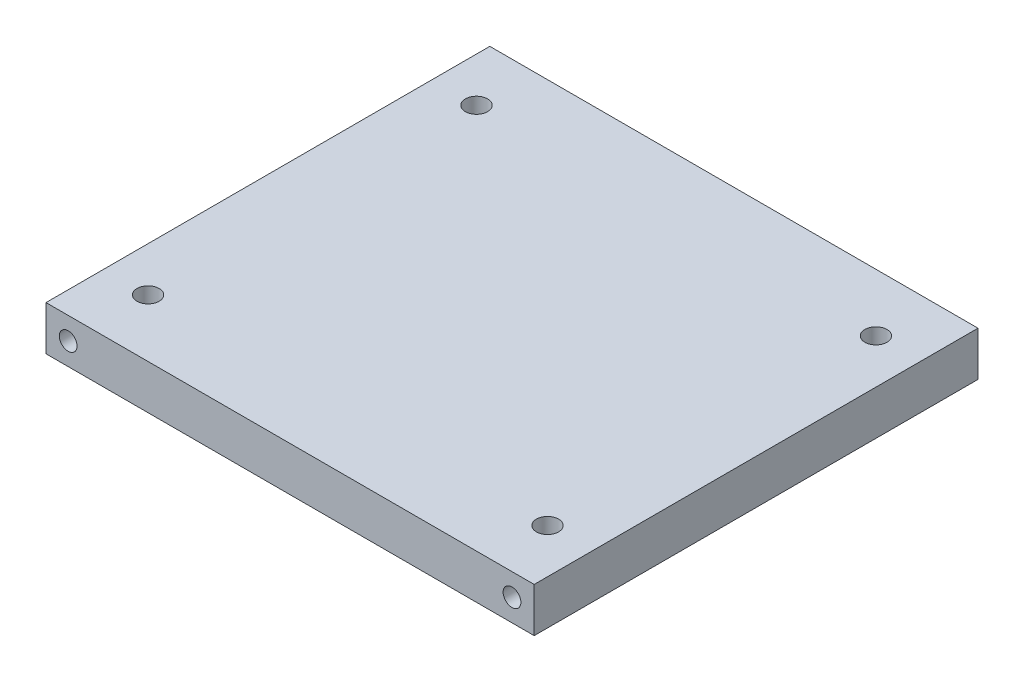
from build123d import *

# Parameters (mm, degrees)
SKETCH1_W           = 110
SKETCH1_H           = 100
BOSS_EXTRUDE1_DEPTH = 10
SKETCH2_R           = 2
CUT_EXTRUDE1_DEPTH  = 115.564392374
SKETCH3_R           = 2.5
CUT_EXTRUDE2_DEPTH  = 10


with BuildPart() as part:
    # Sketch1 → Boss-Extrude1 (new body)
    with BuildSketch(Plane(origin=(0, 0, 0), x_dir=(1, 0, 0), z_dir=(0, 1, 0))):
        Rectangle(SKETCH1_W, SKETCH1_H)
    extrude(amount=BOSS_EXTRUDE1_DEPTH)

    # Sketch2 → Cut-Extrude1 (cut, through all)
    with BuildSketch(Plane.XY.offset(50)):
        with Locations((-50, 5)):
            Circle(SKETCH2_R)
        with Locations(Location((50, 5, 0), (0, 0, 180))):
            Circle(SKETCH2_R)
    extrude(amount=-CUT_EXTRUDE1_DEPTH, mode=Mode.SUBTRACT)

    # Sketch3 → Cut-Extrude2 (cut)
    with BuildSketch(Plane(origin=(0, 10, 0), x_dir=(1, 0, 0), z_dir=(0, 1, 0))):
        with Locations(Location((-45, -37, 0), (0, 0, 270))):
            Circle(SKETCH3_R)
        with Locations(Location((45, -37, 0), (0, 0, 90))):
            Circle(SKETCH3_R)
        with Locations(Location((45, 37, 0), (0, 0, 270))):
            Circle(SKETCH3_R)
        with Locations(Location((-45, 37, 0), (0, 0, 90))):
            Circle(SKETCH3_R)
    extrude(amount=-CUT_EXTRUDE2_DEPTH, mode=Mode.SUBTRACT)


solid = part.part
